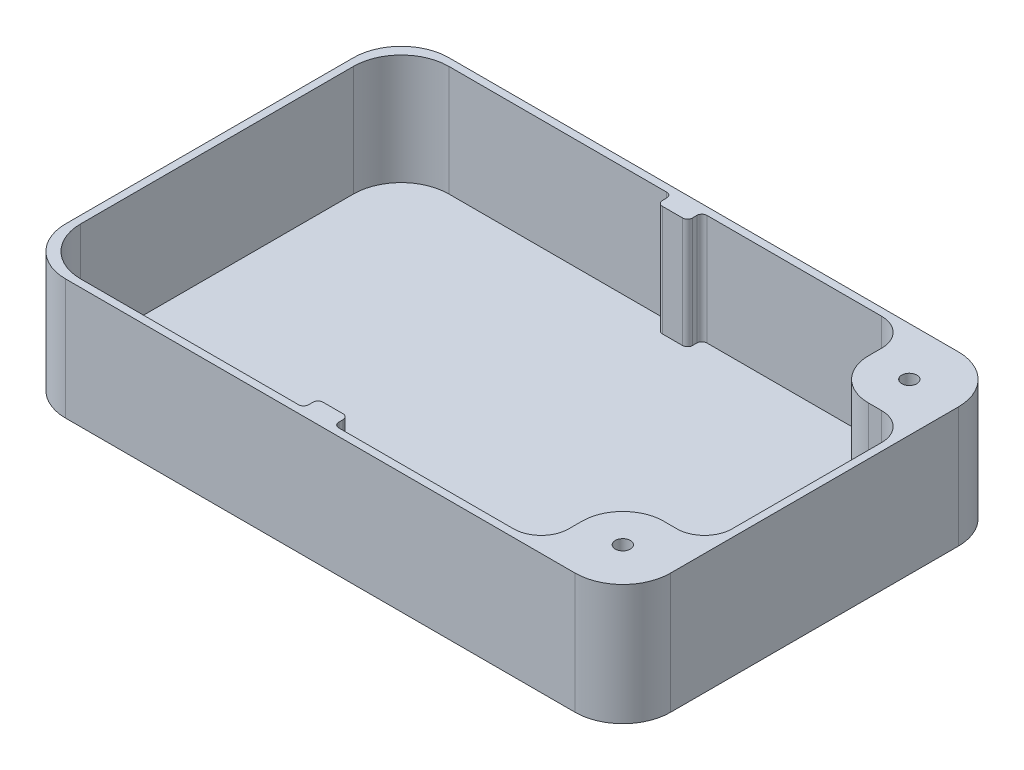
from build123d import *

# Parameters (mm, degrees)
SKETCH1_W           = 120.4
SKETCH1_H           = 76.28
BOSS_EXTRUDE1_DEPTH = 24
FILLET1_R           = 9.5
SKETCH2_R           = 1.5
CUT_EXTRUDE1_DEPTH  = 22


with BuildPart() as part:
    # Sketch1 → Boss-Extrude1 (new body)
    with BuildSketch(Plane(origin=(0, 0, 0), x_dir=(1, 0, 0), z_dir=(0, 1, 0))):
        Rectangle(SKETCH1_W, SKETCH1_H)
    extrude(amount=BOSS_EXTRUDE1_DEPTH)

    # Fillet1
    fillet1_edges = [part.edges().sort_by_distance(p)[0] for p in [
        (60.2, 12, 38.14),
        (-60.2, 12, 38.14),
        (-60.2, 12, -38.14),
        (60.2, 12, -38.14),
    ]]
    fillet(fillet1_edges, radius=FILLET1_R)

    # Sketch2 → Cut-Extrude1 (cut)
    with BuildSketch(Plane(origin=(0, 24, 0), x_dir=(1, 0, 0), z_dir=(0, 1, 0))):
        with Locations(Location((50.57, -28.51, 0), (0, 0, 270))):
            Circle(SKETCH2_R)
        with Locations(Location((50.57, 28.51, 0), (0, 0, 90))):
            Circle(SKETCH2_R)
        with BuildLine():
            Line((-49.2, 36.64), (-5.840999167, 36.64))
            ThreePointArc((-5.840999167, 36.64), (-5.133892386, 36.347106781), (-4.840999167, 35.64))
            Line((-4.840999167, 35.64), (-4.840999167, 34.772736938))
            ThreePointArc((-4.840999167, 34.772736938), (-4.548105948, 34.065630157), (-3.840999167, 33.772736938))
            Line((-3.840999167, 33.772736938), (0.159000833, 33.772736938))
            ThreePointArc((0.159000833, 33.772736938), (0.866107614, 34.065630157), (1.159000833, 34.772736938))
            Line((1.159000833, 34.772736938), (1.159000833, 35.64))
            ThreePointArc((1.159000833, 35.64), (1.451894052, 36.347106781), (2.159000833, 36.64))
            Line((2.159000833, 36.64), (36.94, 36.64))
            ThreePointArc((36.94, 36.64), (40.829087297, 35.029087297), (42.44, 31.14))
            Line((42.44, 31.14), (42.44, 28.51))
            ThreePointArc((42.44, 28.51), (44.821221869, 22.761221869), (50.57, 20.38))
            Line((50.57, 20.38), (53.2, 20.38))
            ThreePointArc((53.2, 20.38), (57.089087297, 18.769087297), (58.7, 14.88))
            Line((58.7, 14.88), (58.7, -14.88))
            ThreePointArc((58.7, -14.88), (57.089087297, -18.769087297), (53.2, -20.38))
            Line((53.2, -20.38), (50.57, -20.38))
            ThreePointArc((50.57, -20.38), (44.821221869, -22.761221869), (42.44, -28.51))
            Line((42.44, -28.51), (42.44, -31.14))
            ThreePointArc((42.44, -31.14), (40.829087297, -35.029087297), (36.94, -36.64))
            Line((36.94, -36.64), (2.159000833, -36.64))
            ThreePointArc((2.159000833, -36.64), (1.451894052, -36.347106781), (1.159000833, -35.64))
            Line((1.159000833, -35.64), (1.159000833, -34.772736938))
            ThreePointArc((1.159000833, -34.772736938), (0.866107614, -34.065630157), (0.159000833, -33.772736938))
            Line((0.159000833, -33.772736938), (-3.840999167, -33.772736938))
            ThreePointArc((-3.840999167, -33.772736938), (-4.548105948, -34.065630157), (-4.840999167, -34.772736938))
            Line((-4.840999167, -34.772736938), (-4.840999167, -35.64))
            ThreePointArc((-4.840999167, -35.64), (-5.133892386, -36.347106781), (-5.840999167, -36.64))
            Line((-5.840999167, -36.64), (-49.2, -36.64))
            ThreePointArc((-49.2, -36.64), (-55.917514421, -33.857514421), (-58.7, -27.14))
            Line((-58.7, -27.14), (-58.7, 27.14))
            ThreePointArc((-58.7, 27.14), (-55.917514421, 33.857514421), (-49.2, 36.64))
        make_face()
    extrude(amount=-CUT_EXTRUDE1_DEPTH, mode=Mode.SUBTRACT)


solid = part.part
